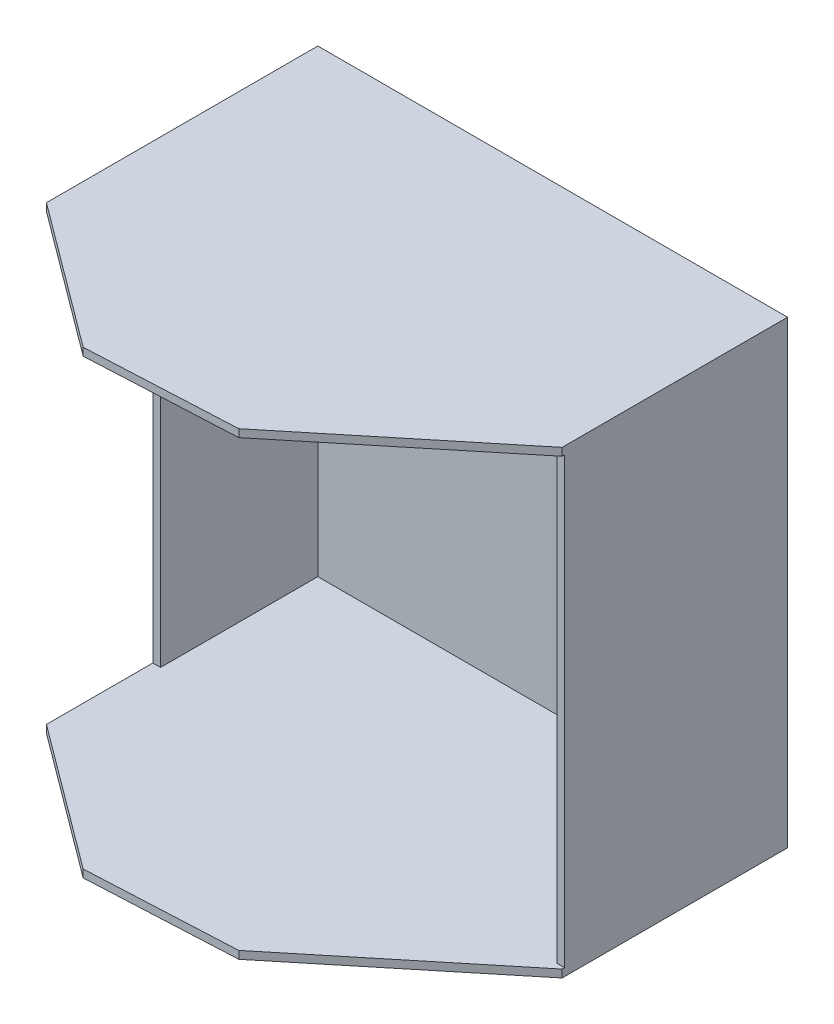
from build123d import *

# Parameters (mm, degrees)
BOSS_EXTRUDE1_DEPTH = 3.2
SKETCH3_R           = 12.3
BOSS_EXTRUDE2_DEPTH = 3.2
SKETCH4_R           = 4
BOSS_EXTRUDE3_DEPTH = 4
SKETCH6_W           = 3.2
SKETCH6_H           = 65
BOSS_EXTRUDE4_DEPTH = 190
SKETCH8_W           = 3.2
SKETCH8_H           = 89
BOSS_EXTRUDE5_DEPTH = 190
SKETCH9_W           = 194.2
SKETCH9_H           = 190
BOSS_EXTRUDE7_DEPTH = 3.2


with BuildPart() as part:
    # Sketch1 → Boss-Extrude1 (new body)
    with BuildSketch(Plane(origin=(0, 0, 0), x_dir=(1, 0, 0), z_dir=(0, 1, 0))):
        Polygon((-71.199297972, 0), (119.800702028, 0), (119.800702028, -90), (46.272924854, -150.155348756), (-15.035731115, -153.181069815), (-74.399297972, -109), (-74.399297972, -65), (-71.199297972, -65), align=None)
    boss_extrude1 = extrude(amount=BOSS_EXTRUDE1_DEPTH)

    # Sketch3 → Boss-Extrude2 (add)
    with BuildSketch(Plane.XZ):
        with Locations(Location((-5.399297972, 108.199281837, 0), (0, 0, 270))):
            Circle(SKETCH3_R)
    extrude(amount=BOSS_EXTRUDE2_DEPTH)

    # Sketch4 → Boss-Extrude3 (add)
    with BuildSketch(Plane.XZ.offset(3.2)):
        with Locations(Location((-5.399297972, 108.199281837, 0), (0, 0, 270))):
            Circle(SKETCH4_R)
    extrude(amount=BOSS_EXTRUDE3_DEPTH)

    # Sketch6 → Boss-Extrude4 (add)
    with BuildSketch(Plane(origin=(0, 0, 0), x_dir=(1, 0, 0), z_dir=(0, 1, 0))):
        with Locations((-72.799297972, -32.5)):
            Rectangle(SKETCH6_W, SKETCH6_H)
    extrude(amount=BOSS_EXTRUDE4_DEPTH)

    # Sketch8 → Boss-Extrude5 (add)
    with BuildSketch(Plane(origin=(0, 0, 0), x_dir=(1, 0, 0), z_dir=(0, 1, 0))):
        with Locations((118.200702028, -44.5)):
            Rectangle(SKETCH8_W, SKETCH8_H)
    extrude(amount=BOSS_EXTRUDE5_DEPTH)

    # Mirror1: Boss-Extrude1 across plane
    add(boss_extrude1.mirror(Plane(origin=(0, 95, 0), x_dir=(0, 0, 1), z_dir=(0, -1, 0))))

    # Sketch9 → Boss-Extrude7 (add)
    with BuildSketch(Plane.XY):
        with Locations((22.700702028, 95)):
            Rectangle(SKETCH9_W, SKETCH9_H)
    extrude(amount=-BOSS_EXTRUDE7_DEPTH)


solid = part.part
